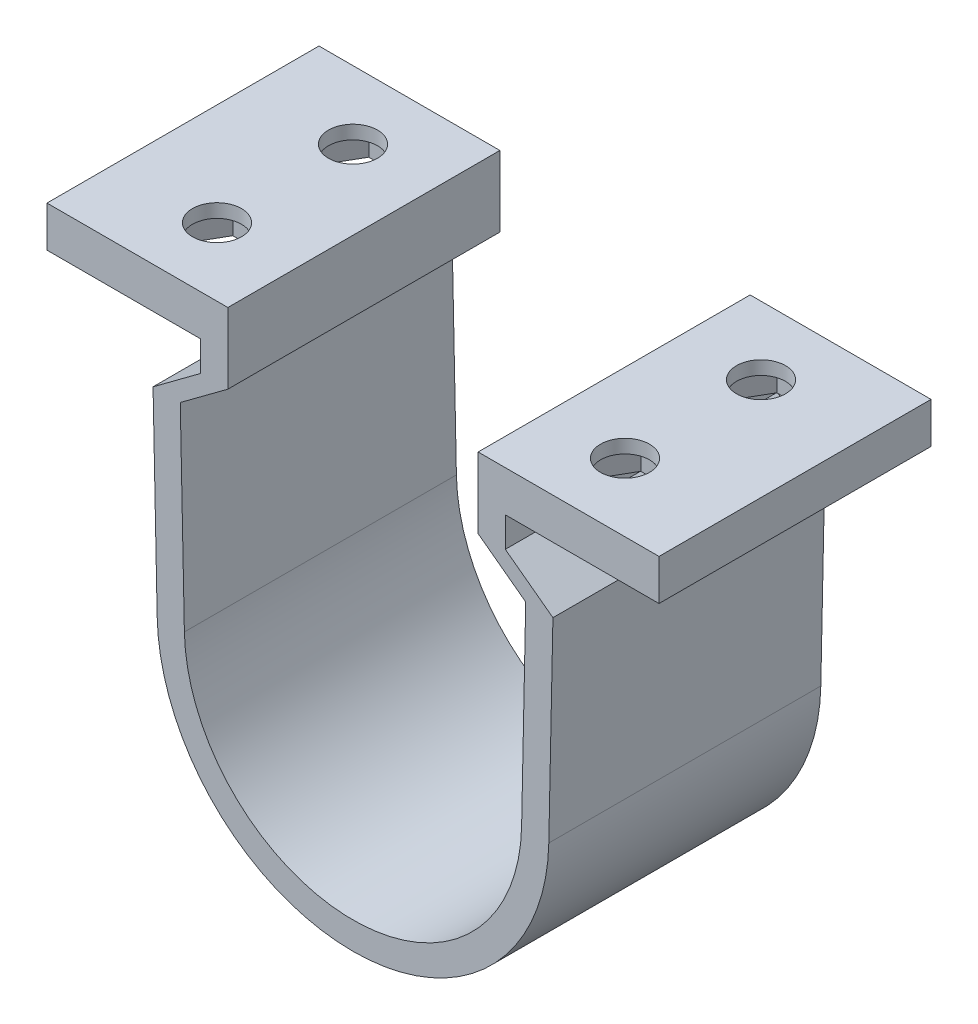
from build123d import *

# Parameters (mm, degrees)
BOSS_EXTRUDE1_DEPTH      = 20
CUT_EXTRUDE1_DEPTH       = 2
M3_CLEARANCE_HOLE1_D     = 3.6
M3_CLEARANCE_HOLE1_DEPTH = 3


with BuildPart() as part:
    # Sketch1 → Boss-Extrude1 (new body)
    with BuildSketch(Plane.XY):
        with BuildLine():
            Line((-22.5, 19), (-11.2, 19))
            Line((-11.2, 19), (-11.2, 16.8))
            Line((-11.2, 16.8), (-14.700438244, 14.2))
            Line((-14.700438244, 14.2), (-14.396845337, -0.301403929))
            ThreePointArc((-14.396845337, -0.301403929), (0, -14.4), (14.396845337, -0.301403929))
            Line((14.396845337, -0.301403929), (14.700438244, 14.2))
            Line((14.700438244, 14.2), (11.2, 16.8))
            Line((11.2, 16.8), (11.2, 19))
            Line((11.2, 19), (22.5, 19))
            Line((22.5, 19), (22.5, 22))
            Line((22.5, 22), (9.2, 22))
            Line((9.2, 22), (9.2, 16.799674488))
            Line((9.2, 16.799674488), (12.7, 14.2))
            Line((12.7, 14.2), (12.397283485, -0.259542272))
            ThreePointArc((12.397283485, -0.259542272), (0, -12.4), (-12.397283485, -0.259542272))
            Line((-12.397283485, -0.259542272), (-12.7, 14.2))
            Line((-12.7, 14.2), (-9.2, 16.799674488))
            Line((-9.2, 16.799674488), (-9.2, 22))
            Line((-9.2, 22), (-22.5, 22))
            Line((-22.5, 22), (-22.5, 19))
        make_face()
    extrude(amount=BOSS_EXTRUDE1_DEPTH)

    # Sketch4 → Cut-Extrude1 (cut)
    with BuildSketch(Plane.XZ.offset(-19)):
        Polygon((-13.41228676, 2.25), (-11.824573519, 5), (-13.41228676, 7.75), (-16.58771324, 7.75), (-18.175426481, 5), (-16.58771324, 2.25), align=None)
        Polygon((-11.824573519, 15), (-13.41228676, 17.75), (-16.58771324, 17.75), (-18.175426481, 15), (-16.58771324, 12.25), (-13.41228676, 12.25), align=None)
        Polygon((13.41228676, 12.25), (11.824573519, 15), (13.41228676, 17.75), (16.58771324, 17.75), (18.175426481, 15), (16.58771324, 12.25), align=None)
        Polygon((16.58771324, 2.25), (13.41228676, 2.25), (11.824573519, 5), (13.41228676, 7.75), (16.58771324, 7.75), (18.175426481, 5), align=None)
    extrude(amount=-CUT_EXTRUDE1_DEPTH, mode=Mode.SUBTRACT)

    # M3 Clearance Hole1
    with Locations(Plane(origin=(0, 19, 0), x_dir=(-1, 0, 0), z_dir=(0, -1, 0))):
        with Locations((-15, -15), (15, -15), (-15, -5), (15, -5)):
            Hole(M3_CLEARANCE_HOLE1_D / 2, depth=M3_CLEARANCE_HOLE1_DEPTH)


solid = part.part
